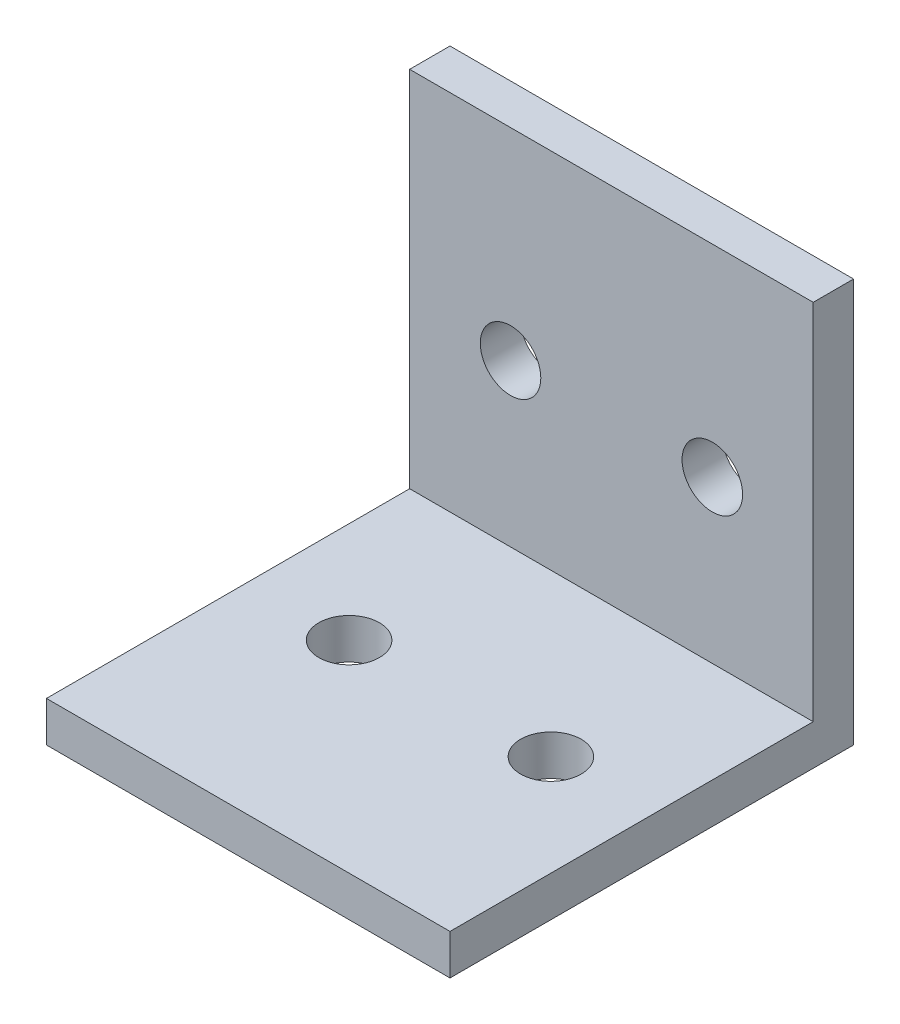
from build123d import *

# Parameters (mm, degrees)
SKETCH_1_W          = 20
SKETCH_1_H          = 20
EXTRUDE_1_DEPTH     = 2
SKETCH_2_W          = 20
SKETCH_2_H          = 2
EXTRUDE_2_DEPTH     = 18
SKETCH_4_R          = 1.5
CUT_EXTRUDE_1_DEPTH = 18
SKETCH_6_R          = 1.5
CUT_EXTRUDE_2_DEPTH = 18


with BuildPart() as part:
    # 草图1 → 凸台-拉伸1 (new body)
    with BuildSketch(Plane.XY):
        Rectangle(SKETCH_1_W, SKETCH_1_H)
    extrude(amount=EXTRUDE_1_DEPTH)

    # 草图2 → 凸台-拉伸2 (add)
    with BuildSketch(Plane.XY.offset(2)):
        with Locations((0, -9)):
            Rectangle(SKETCH_2_W, SKETCH_2_H)
    extrude(amount=EXTRUDE_2_DEPTH)

    # 草图4 → 切除-拉伸1 (cut)
    with BuildSketch(Plane.XZ.offset(10)):
        with Locations(Location((-5, 10, 0), (0, 0, 270))):
            Circle(SKETCH_4_R)
        with Locations(Location((5, 10, 0), (0, 0, 270))):
            Circle(SKETCH_4_R)
    extrude(amount=-CUT_EXTRUDE_1_DEPTH, mode=Mode.SUBTRACT)

    # 草图6 → 切除-拉伸2 (cut)
    with BuildSketch(Plane(origin=(0, 0, 0), x_dir=(-1, 0, 0), z_dir=(0, 0, -1))):
        with Locations((5, 0)):
            Circle(SKETCH_6_R)
        with Locations((-5, 0)):
            Circle(SKETCH_6_R)
    extrude(amount=-CUT_EXTRUDE_2_DEPTH, mode=Mode.SUBTRACT)


solid = part.part
